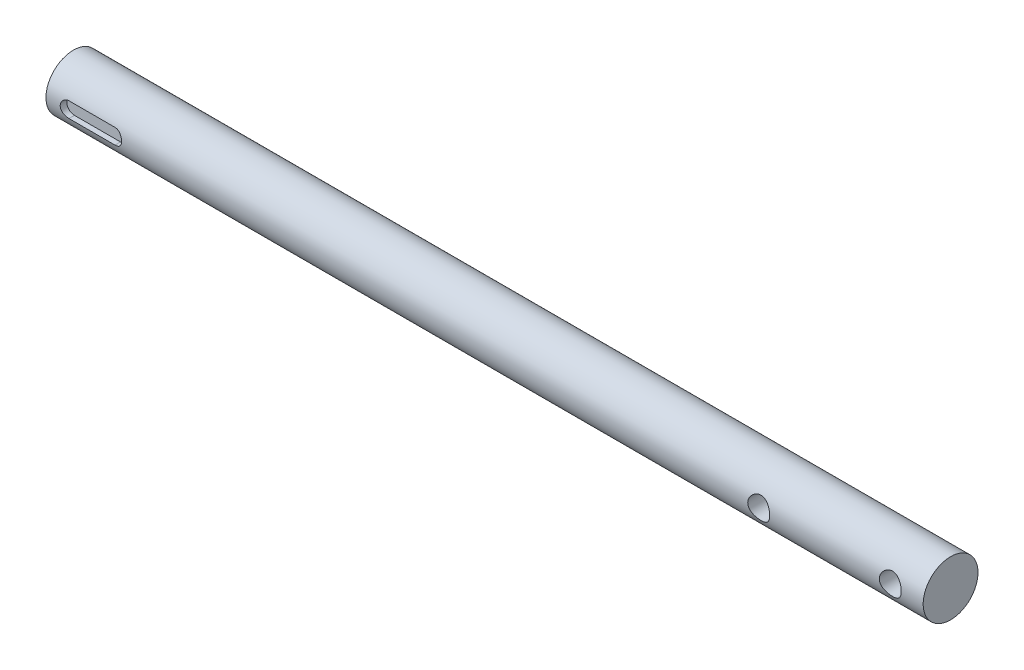
from build123d import *

# Parameters (mm, degrees)
SKETCH1_R           = 25
BOSS_EXTRUDE1_DEPTH = 400
SKETCH2_R           = 10
CUT_EXTRUDE1_DEPTH  = 160
CUT_EXTRUDE2_DEPTH  = 6


with BuildPart() as part:
    # Sketch1 → Boss-Extrude1 (new, symmetric)
    with BuildSketch(Plane(origin=(0, 0, 0), x_dir=(0, 0, -1), z_dir=(1, 0, 0))):
        Circle(SKETCH1_R)
    extrude(amount=BOSS_EXTRUDE1_DEPTH, both=True)

    # Sketch2 → Cut-Extrude1 (cut, symmetric)
    with BuildSketch(Plane.XY):
        with Locations((370, 0)):
            Circle(SKETCH2_R)
        with Locations((250, 0)):
            Circle(SKETCH2_R)
    extrude(amount=CUT_EXTRUDE1_DEPTH, both=True, mode=Mode.SUBTRACT)

    # Sketch3 → Cut-Extrude2 (cut)
    with BuildSketch(Plane.XY.offset(25)):
        with BuildLine():
            Line((-380, 7), (-338, 7))
            ThreePointArc((-338, 7), (-331, 0), (-338, -7))
            Line((-338, -7), (-380, -7))
            ThreePointArc((-380, -7), (-387, 0), (-380, 7))
        make_face()
    extrude(amount=-CUT_EXTRUDE2_DEPTH, mode=Mode.SUBTRACT)


solid = part.part
